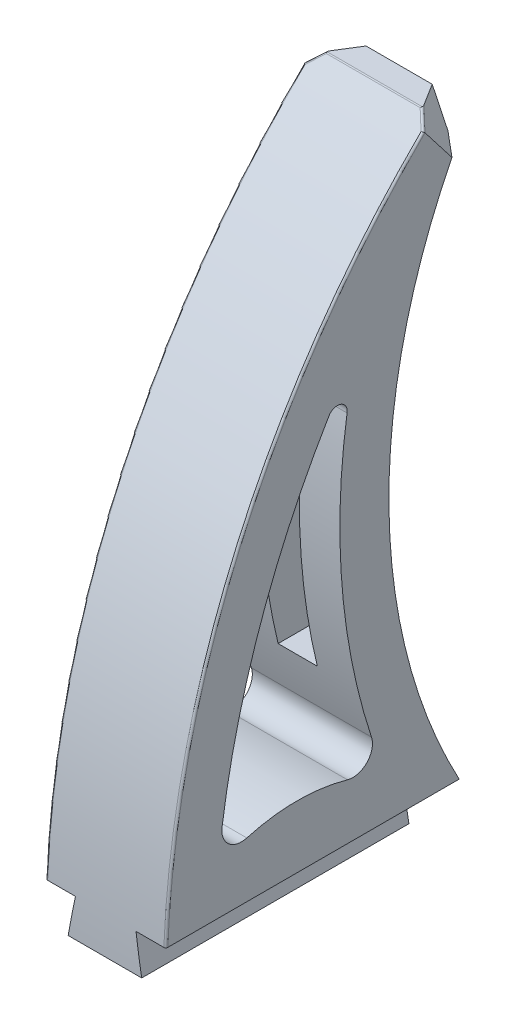
from build123d import *

# Parameters (mm, degrees)
BOSS_EXTRUDE1_DEPTH = 76.2
SKETCH2_W           = 6.985
SKETCH2_H           = 9.525
CUT_EXTRUDE1_DEPTH  = 119.84173867
CUT_EXTRUDE2_DEPTH  = 119.84173867
CUT_EXTRUDE3_DEPTH  = 119.84173867
FILLET1_R           = 2.54
CUT_EXTRUDE4_DEPTH  = 5.08
CUT_EXTRUDE6_DEPTH  = 15.113
FILLET2_R           = 0.508


with BuildPart() as part:
    # Sketch1 → Boss-Extrude1 (new body)
    with BuildSketch(Plane.XY):
        Polygon((-15.5575, 76.2), (15.5575, 76.2), (15.5575, -76.2), (7.845485509, -76.2), (9.525, -85.725), (-9.525, -85.725), (-7.845485509, -76.2), (-15.5575, -76.2), align=None)
    extrude(amount=BOSS_EXTRUDE1_DEPTH)

    # Sketch2 → Cut-Extrude1 (cut, through all)
    with BuildSketch(Plane(origin=(15.5575, 0, 0), x_dir=(0, 0, -1), z_dir=(1, 0, 0))):
        with Locations((-3.4925, -80.9625)):
            Rectangle(SKETCH2_W, SKETCH2_H)
    extrude(amount=-CUT_EXTRUDE1_DEPTH, mode=Mode.SUBTRACT)

    # Sketch3 → Cut-Extrude2 (cut, through all)
    with BuildSketch(Plane(origin=(15.5575, 0, 0), x_dir=(0, 0, -1), z_dir=(1, 0, 0))):
        with BuildLine():
            Line((-76.2, -85.725), (-76.2, -76.2))
            Line((-76.2, -76.2), (-76.2, 76.2))
            Line((-76.2, 76.2), (-6.541803462, 76.2))
            ThreePointArc((-6.541803462, 76.2), (-58.046669251, 2.411215556), (-76.2, -85.725))
        make_face()
        with BuildLine():
            Line((0, -76.2), (0, 67.75939176))
            ThreePointArc((0, 67.75939176), (-18.20597202, -4.22030412), (0, -76.2))
        make_face()
    extrude(amount=-CUT_EXTRUDE2_DEPTH, mode=Mode.SUBTRACT)

    # Sketch6 → Cut-Extrude3 (cut, through all)
    with BuildSketch(Plane(origin=(15.5575, 0, 0), x_dir=(0, 0, -1), z_dir=(1, 0, 0))):
        with BuildLine():
            ThreePointArc((-28.934409948, -61.883434575), (-23.879909813, -60.517759582), (-22.716254779, -55.412963136))
            ThreePointArc((-22.716254779, -55.412963136), (-30.753414225, -11.294498854), (-26.546552055, 33.352305435))
            ThreePointArc((-26.546552055, 33.352305435), (-49.181053892, -9.446405872), (-61.429710833, -56.286781256))
            ThreePointArc((-61.429710833, -56.286781256), (-59.737369376, -60.827463042), (-55.008021131, -61.883434575))
            ThreePointArc((-55.008021131, -61.883434575), (-41.971215539, -60.062859411), (-28.934409948, -61.883434575))
        make_face()
    extrude(amount=-CUT_EXTRUDE3_DEPTH, mode=Mode.SUBTRACT)

    # Fillet1
    fillet1_edges = [part.edges().sort_by_distance(p)[0] for p in [
        (0, 33.352305435, 26.546552055),
    ]]
    fillet(fillet1_edges, radius=FILLET1_R)

    # Sketch7 → Cut-Extrude4 (cut, symmetric)
    with BuildSketch(Plane(origin=(0, 0, 0), x_dir=(0, 0, -1), z_dir=(1, 0, 0))):
        with BuildLine():
            Line((-30.699128799, 4.016230293), (-17.981752538, 4.016230293))
            ThreePointArc((-17.981752538, 4.016230293), (-17.415803594, -19.667907964), (-13.161921654, -42.973769707))
            Line((-13.161921654, -42.973769707), (-26.264177108, -42.973769707))
            ThreePointArc((-26.264177108, -42.973769707), (-30.179968378, -19.639057999), (-30.699128799, 4.016230293))
        make_face()
    extrude(amount=CUT_EXTRUDE4_DEPTH, both=True, mode=Mode.SUBTRACT)

    # Sketch10 → Cut-Extrude6 (cut, symmetric)
    with BuildSketch(Plane(origin=(15.5575, 76.2, 6.541803462), x_dir=(-1, 0, 0), z_dir=(0, -0.7903999954772005, -0.6125910929401777))):
        Polygon((0, 5.170641427), (6.985, 5.170641427), (0, -3.655858573), align=None)
        Polygon((31.115, 5.170641427), (31.115, -3.655858573), (24.13, 5.170641427), align=None)
    extrude(amount=CUT_EXTRUDE6_DEPTH, both=True, mode=Mode.SUBTRACT)

    # Fillet2
    fillet2_edges = [part.edges().sort_by_distance(p)[0] for p in [
        (0, 76.2, 6.541803462),
        (-14.111333502, 74.930435776, 7.871138317),
        (14.111333502, 74.930435776, 7.871138317),
        (-15.5575, 5.090891194, 56.873019023),
        (15.5575, 5.090891194, 56.873019023),
    ]]
    fillet(fillet2_edges, radius=FILLET2_R)


solid = part.part
